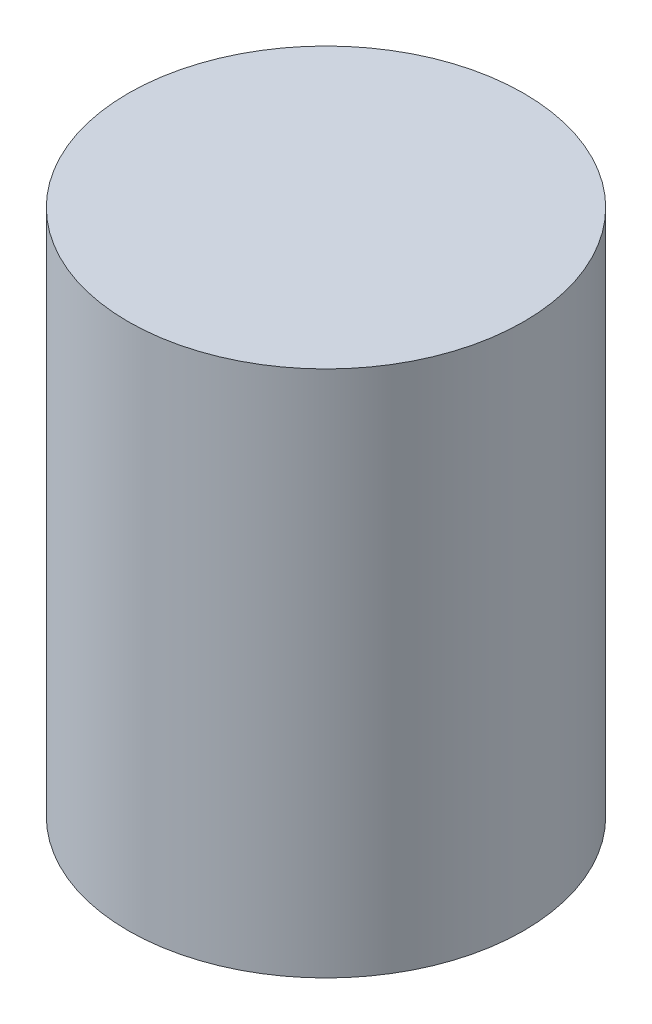
from build123d import *

# Parameters (mm, degrees)
SKETCH_1_R      = 30
EXTRUDE_1_DEPTH = 40


with BuildPart() as part:
    # 草图1 → 凸台-拉伸1 (new, symmetric)
    with BuildSketch(Plane(origin=(0, 0, 0), x_dir=(1, 0, 0), z_dir=(0, 1, 0))):
        with Locations(Location((0, 0, 0), (0, 0, 270))):
            Circle(SKETCH_1_R)
    extrude(amount=EXTRUDE_1_DEPTH, both=True)


solid = part.part
